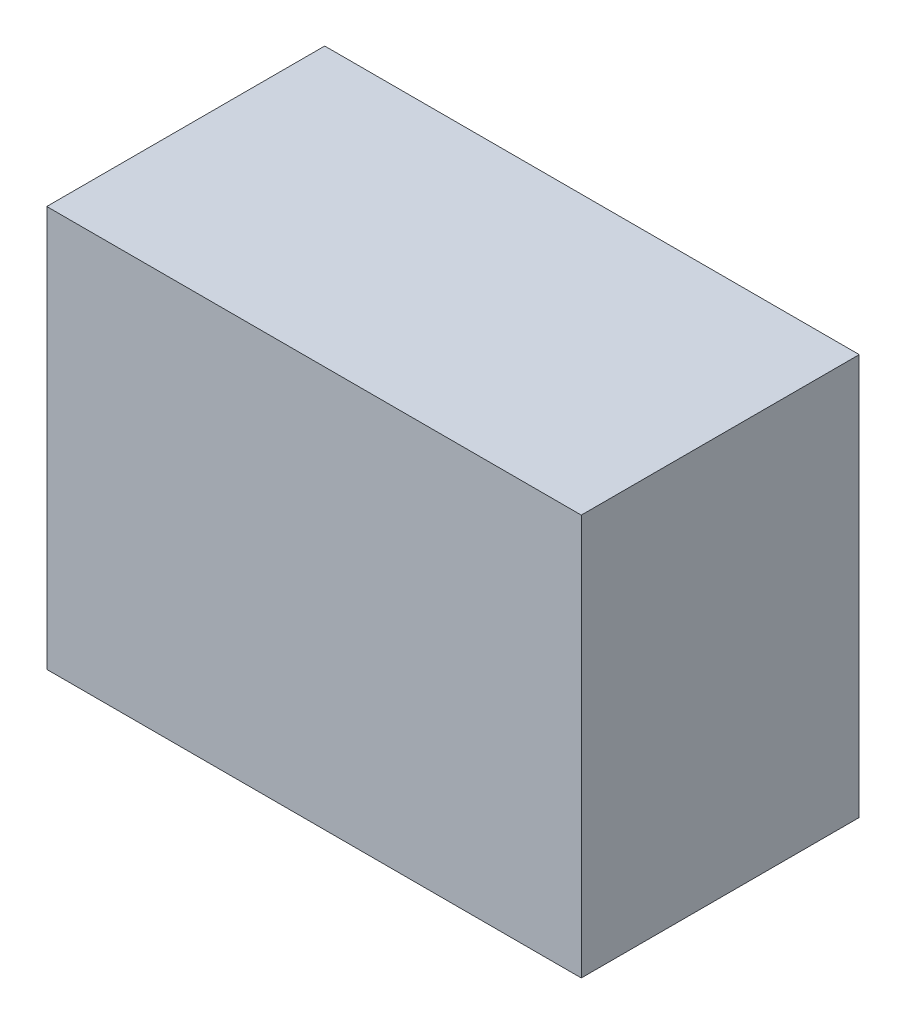
from build123d import *

# Parameters (mm, degrees)
SKETCH1_W           = 20
SKETCH1_H           = 15
BOSS_EXTRUDE1_DEPTH = 10.4


with BuildPart() as part:
    # Sketch1 → Boss-Extrude1 (new body)
    with BuildSketch(Plane.XY):
        Rectangle(SKETCH1_W, SKETCH1_H)
    extrude(amount=BOSS_EXTRUDE1_DEPTH)


solid = part.part
